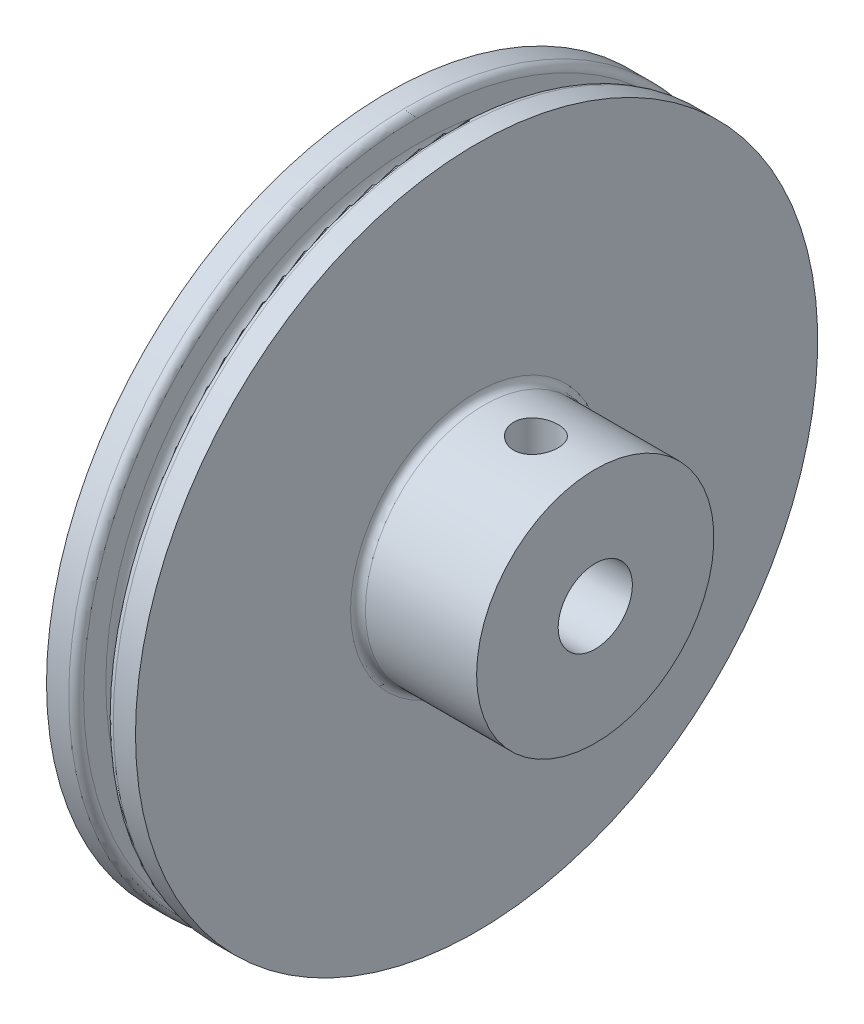
from build123d import *

# Parameters (mm, degrees)
CUT_EXTRUDE3_DEPTH      = 2
CUT_EXTRUDE3_DEPTH_BACK = 8
SKETCH7_R               = 1.5


with BuildPart() as part:
    # Sketch1 → Revolve1 (revolve)
    with BuildSketch(Plane.XY, mode=Mode.PRIVATE) as revolve1_sk:
        with BuildLine():
            Line((-11.54268079, 15.022902393), (-10.04268079, 15.022902393))
            ThreePointArc((-10.04268079, 15.022902393), (-9.689127399, 14.876455783), (-9.54268079, 14.522902393))
            Line((-9.54268079, 14.522902393), (-9.54268079, 13.022902453))
            ThreePointArc((-9.54268079, 13.022902453), (-8.54268079, 12.022902453), (-7.54268079, 13.022902453))
            Line((-7.54268079, 13.022902453), (-7.54268079, 14.522902393))
            ThreePointArc((-7.54268079, 14.522902393), (-7.396234181, 14.876455783), (-7.04268079, 15.022902393))
            Line((-7.04268079, 15.022902393), (-5.54268079, 15.022902393))
            Line((-5.54268079, 15.022902393), (-5.54268079, 0.522902393))
            ThreePointArc((-5.54268079, 0.522902393), (-5.396234181, 0.169349002), (-5.04268079, 0.022902393))
            Line((-5.04268079, 0.022902393), (2.45731921, 0.022902393))
            Line((2.45731921, 0.022902393), (2.45731921, -5.477097607))
            Line((2.45731921, -5.477097607), (-11.54268079, -5.477097607))
            Line((-11.54268079, -5.477097607), (-11.54268079, 15.022902393))
        make_face()
    revolve(revolve1_sk.sketch.rotate(Axis((-11.54268079, -7.977097607, 0), (1, 0, 0)), 90), axis=Axis((-11.54268079, -7.977097607, 0), (1, 0, 0)))

    # Sketch7 → Cut-Extrude3 (cut, two sides: drawn at the far end of the back side and taken through both)
    with BuildSketch(Plane(origin=(0, 0, 0), x_dir=(1, 0, 0), z_dir=(0, 1, 0)).offset(-CUT_EXTRUDE3_DEPTH_BACK)):
        with Locations(Location((-1.54268079, 0, 0), (0, 0, 90))):
            Circle(SKETCH7_R)
    extrude(amount=CUT_EXTRUDE3_DEPTH + CUT_EXTRUDE3_DEPTH_BACK, mode=Mode.SUBTRACT)


solid = part.part
